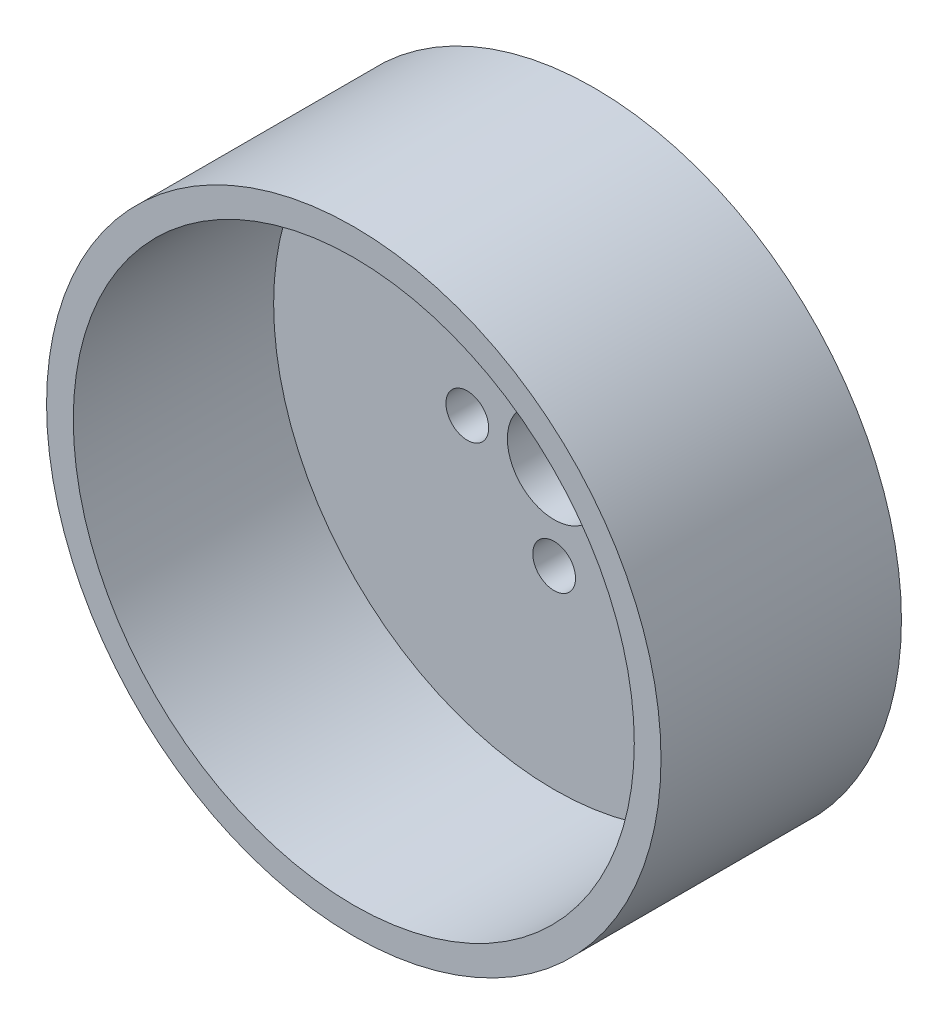
from build123d import *

# Parameters (mm, degrees)
SKETCH_2_R          = 1.6
CUT_EXTRUDE_1_DEPTH = 10


with BuildPart() as part:
    # 草图1 → 旋转1 (revolve)
    with BuildSketch(Plane(origin=(0, 0, 0), x_dir=(1, 0, 0), z_dir=(0, 1, 0))):
        Polygon((-3.5, 0), (-23, 0), (-23, -18), (-21, -18), (-21, -3), (-3.5, -3), align=None)
    revolve(axis=Axis((0, 0, 0), (0, 0, 1)))

    # 草图2 → 切除-拉伸1 (cut)
    with BuildSketch(Plane(origin=(0, 0, 0), x_dir=(-1, 0, 0), z_dir=(0, 0, -1))):
        with Locations((6.5, 0)):
            Circle(SKETCH_2_R)
        with Locations((0, -6.5)):
            Circle(SKETCH_2_R)
        with Locations((-6.5, 0)):
            Circle(SKETCH_2_R)
        with Locations((0, 6.5)):
            Circle(SKETCH_2_R)
    extrude(amount=-CUT_EXTRUDE_1_DEPTH, mode=Mode.SUBTRACT)


solid = part.part
